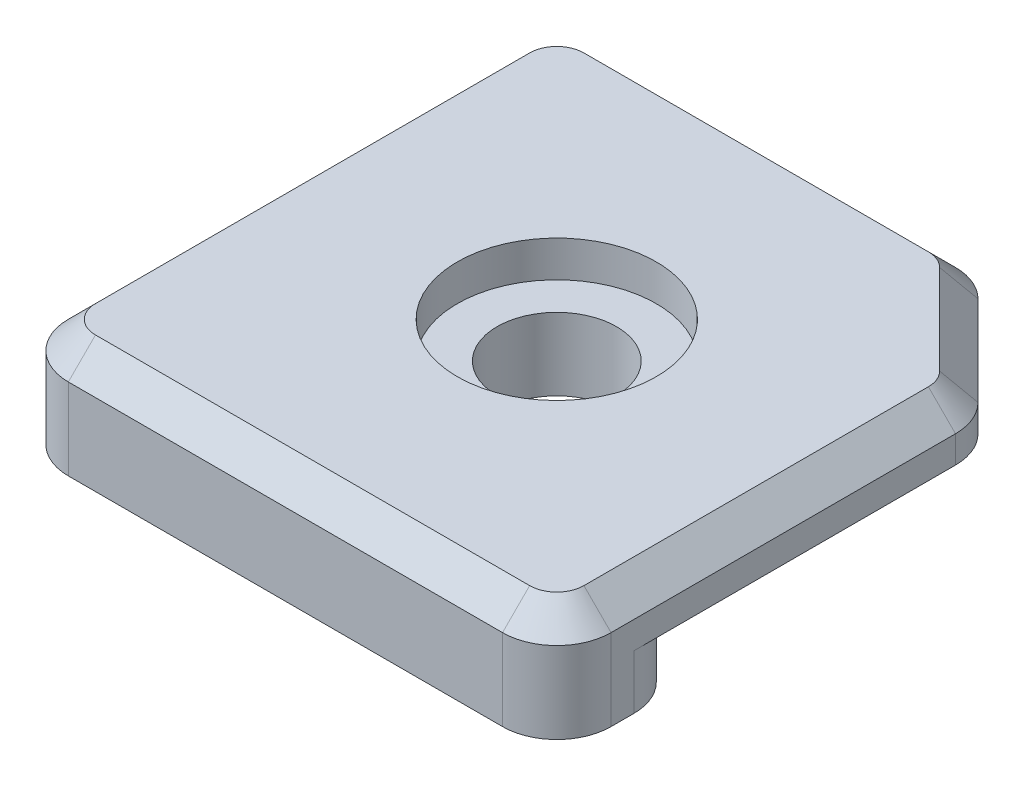
from build123d import *

# Parameters (mm, degrees)
SKETCH1_W                                           = 30
SKETCH1_H                                           = 30
BOSS_EXTRUDE1_DEPTH                                 = 6
CUT_EXTRUDE1_DEPTH                                  = 3
CUT_EXTRUDE2_DEPTH                                  = 22.424285286
FILLET1_R                                           = 3
CHAMFER1_SIZE                                       = 1.5
CBORE_FOR_M6_HEX_SOCKET_HEAD_CAP_SCREW1_D           = 6.6
CBORE_FOR_M6_HEX_SOCKET_HEAD_CAP_SCREW1_CBORE_D     = 11
CBORE_FOR_M6_HEX_SOCKET_HEAD_CAP_SCREW1_CBORE_DEPTH = 2


with BuildPart() as part:
    # Sketch1 → Boss-Extrude1 (new body)
    with BuildSketch(Plane(origin=(0, 0, 0), x_dir=(1, 0, 0), z_dir=(0, 1, 0))):
        Rectangle(SKETCH1_W, SKETCH1_H)
    extrude(amount=BOSS_EXTRUDE1_DEPTH)

    # Sketch2 → Cut-Extrude1 (cut)
    with BuildSketch(Plane.XZ):
        Polygon((15, 9.5), (-9.5, -15), (15, -15), align=None)
    extrude(amount=-CUT_EXTRUDE1_DEPTH, mode=Mode.SUBTRACT)

    # Sketch3 → Cut-Extrude2 (cut, through all)
    with BuildSketch(Plane.XZ.offset(-3)):
        Polygon((15, -8.282485579), (15, -15), (8.282485579, -15), align=None)
    extrude(amount=-CUT_EXTRUDE2_DEPTH, mode=Mode.SUBTRACT)

    # Fillet1
    fillet1_edges = [part.edges().sort_by_distance(p)[0] for p in [
        (15, 1.5, 9.5),
        (-9.5, 1.5, -15),
        (8.282485579, 4.5, -15),
        (15, 4.5, -8.282485579),
        (15, 3, 15),
        (-15, 3, 15),
        (-15, 3, -15),
    ]]
    fillet(fillet1_edges, radius=FILLET1_R)

    # Chamfer1
    chamfer1_edges = [part.edges().sort_by_distance(p)[0] for p in [
        (15, 6, 2.480077554),
        (-2.480077554, 6, -15),
        (0, 6, 15),
        (-15, 6, 0),
        (11.641242789, 6, -11.641242789),
        (14.121320344, 6, 14.121320344),
        (14.771638598, 6, -8.187895189),
        (8.187895189, 6, -14.771638598),
        (-14.121320344, 6, -14.121320344),
        (-14.121320344, 6, 14.121320344),
    ]]
    chamfer(chamfer1_edges, length=CHAMFER1_SIZE)

    # CBORE for M6 Hex Socket Head Cap Screw1 (through all)
    with Locations(Plane(origin=(0, 6, 0), x_dir=(1, 0, 0), z_dir=(0, 1, 0))):
        with Locations((0, 0)):
            CounterBoreHole(CBORE_FOR_M6_HEX_SOCKET_HEAD_CAP_SCREW1_D / 2, CBORE_FOR_M6_HEX_SOCKET_HEAD_CAP_SCREW1_CBORE_D / 2, CBORE_FOR_M6_HEX_SOCKET_HEAD_CAP_SCREW1_CBORE_DEPTH)


solid = part.part
